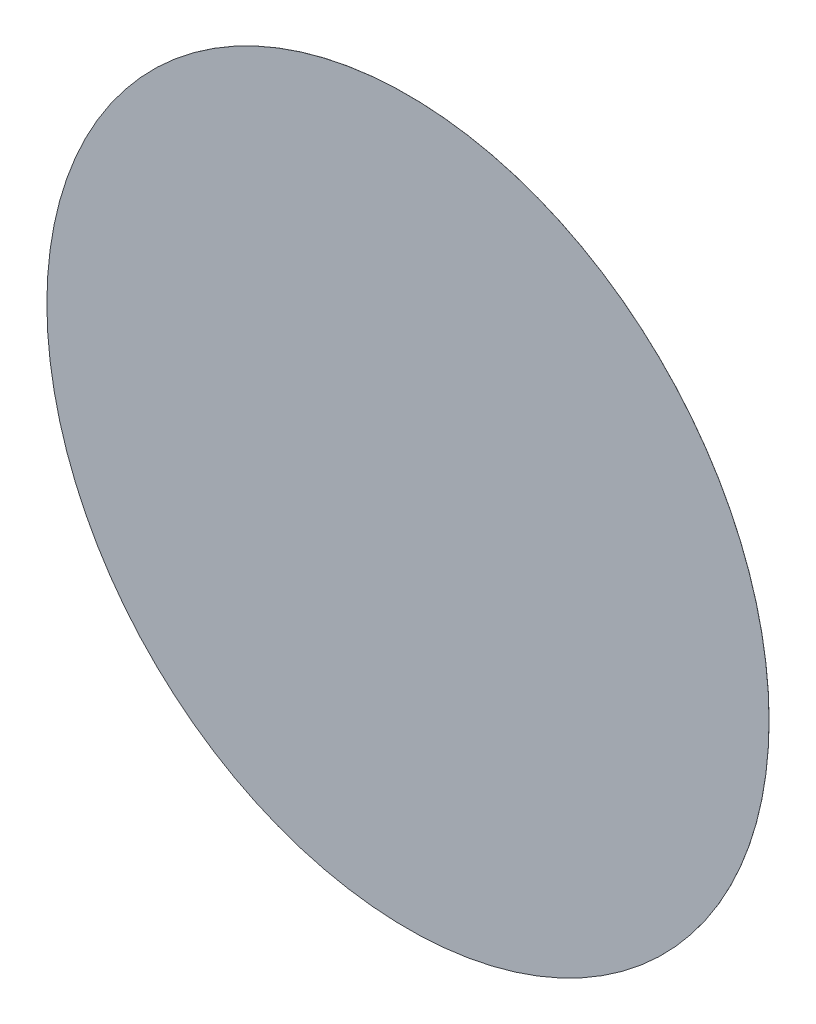
from build123d import *

# Parameters (mm, degrees)
SKETCH1_R           = 818.837232426
BOSS_EXTRUDE2_DEPTH = 0.15


with BuildPart() as part:
    # Sketch1 → Boss-Extrude2 (new body)
    with BuildSketch(Plane(origin=(-127, 0, 0), x_dir=(1, 0, 0), z_dir=(0, 0, 1))):
        with Locations((-78.267479393, 78.610321849)):
            Circle(SKETCH1_R)
    extrude(amount=BOSS_EXTRUDE2_DEPTH)


solid = part.part
